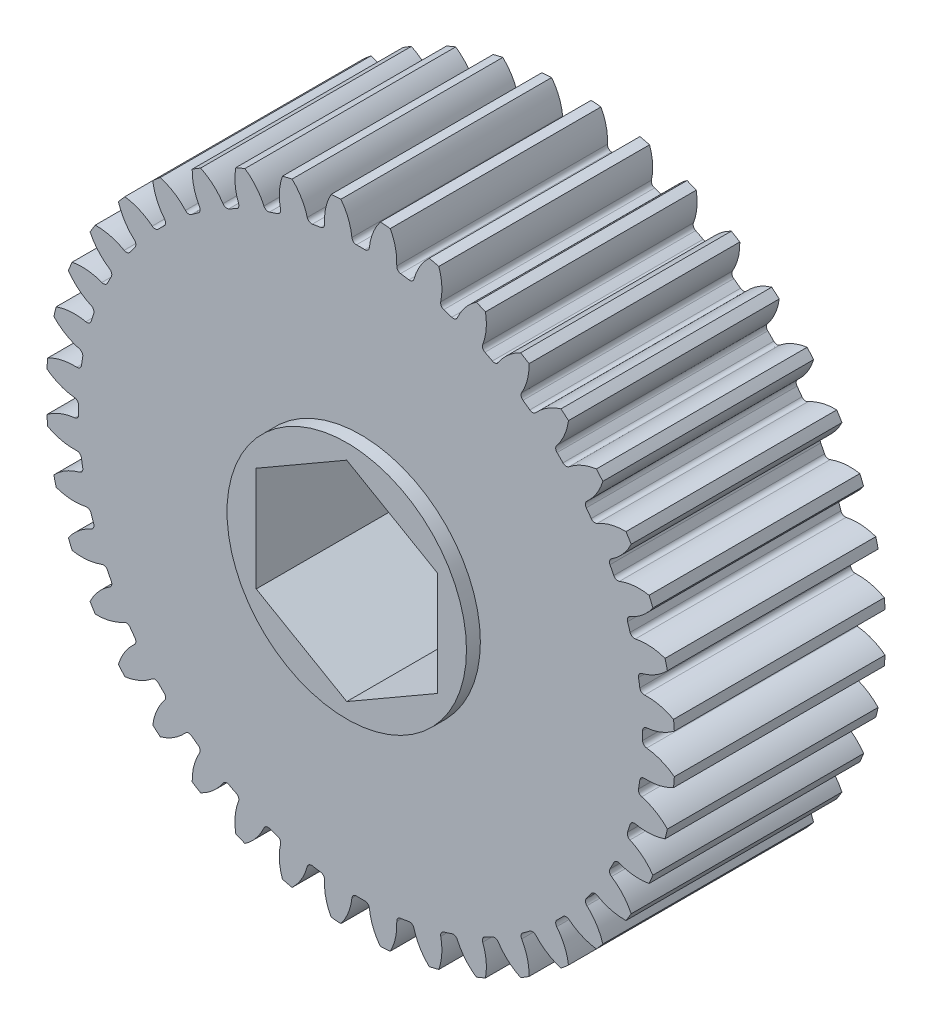
from build123d import *

# Parameters (mm, degrees)
CROQUIS1_R                 = 16.66875
SALIENTE_EXTRUIR1_DEPTH    = 5.588
CORTAR_EXTRUIR1_DEPTH      = 25.226435915
REDONDEO1_R                = 0.238142541
MATRIZC1_COUNT             = 40
REDONDEO1_OF_MATRIZC1_R    = 0.238142541
CROQUIS3_R                 = 6.35
SALIENTE_EXTRUIR2_DEPTH    = 6.3246
CORTAR_EXTRUIR2_DEPTH      = 25.362006212
CORTAR_EXTRUIR2_DEPTH_BACK = 25.362006212


with BuildPart() as part:
    # Croquis1 → Saliente-Extruir1 (new, symmetric)
    with BuildSketch(Plane.XY):
        Circle(CROQUIS1_R)
    extrude(amount=SALIENTE_EXTRUIR1_DEPTH, both=True)

    # Croquis2 → Cortar-Extruir1 (cut, symmetric)
    with BuildSketch(Plane.XY):
        with BuildLine():
            ThreePointArc((0.448148719, 14.949915755), (0, 14.95663125), (-0.448148719, 14.949915755))
            ThreePointArc((-0.448148719, 14.949915755), (-0.614972574, 15.839720541), (-1.045867644, 16.635906571))
            ThreePointArc((-1.045867644, 16.635906571), (0, 16.66875), (1.045867644, 16.635906571))
            ThreePointArc((1.045867644, 16.635906571), (0.614972574, 15.839720541), (0.448148719, 14.949915755))
        make_face()
    cortar_extruir1 = extrude(amount=CORTAR_EXTRUIR1_DEPTH, both=True, mode=Mode.SUBTRACT)

    # Redondeo1
    redondeo1_edges = [part.edges().sort_by_distance(p)[0] for p in [
        (0.448148719, 14.949915755, 0),
        (-0.448148719, 14.949915755, 0),
    ]]
    fillet(redondeo1_edges, radius=REDONDEO1_R)

    # MatrizC1: Cortar-Extruir1 ×40 about axis
    matrizc1_axis = Axis((0, 0, 0), (0, 0, 1))
    for i in range(1, MATRIZC1_COUNT):
        add(cortar_extruir1.rotate(matrizc1_axis, i * 360 / MATRIZC1_COUNT), mode=Mode.SUBTRACT)

    # Redondeo1 of MatrizC1
    redondeo1_of_matrizc1_edges = [part.edges().sort_by_distance(p)[0] for p in [
        (-1.896050809, 14.835963389, 0),
        (-2.781313338, 14.695751579, 0),
        (-4.193563273, 14.356700367, 0),
        (-5.045992792, 14.079729227, 0),
        (-6.387816292, 13.523927734, 0),
        (-7.186423157, 13.117017213, 0),
        (-8.424780074, 12.358151118, 0),
        (-9.149899933, 11.831320702, 0),
        (-10.25429781, 10.888075806, 0),
        (-10.888075806, 10.25429781, 0),
        (-11.831320702, 9.149899933, 0),
        (-12.358151118, 8.424780074, 0),
        (-13.117017213, 7.186423157, 0),
        (-13.523927734, 6.387816292, 0),
        (-14.079729227, 5.045992792, 0),
        (-14.356700367, 4.193563273, 0),
        (-14.695751579, 2.781313338, 0),
        (-14.835963389, 1.896050809, 0),
        (-14.949915755, 0.448148719, 0),
        (-14.949915755, -0.448148719, 0),
        (-14.835963389, -1.896050809, 0),
        (-14.695751579, -2.781313338, 0),
        (-14.356700367, -4.193563273, 0),
        (-14.079729227, -5.045992792, 0),
        (-13.523927734, -6.387816292, 0),
        (-13.117017213, -7.186423157, 0),
        (-12.358151118, -8.424780074, 0),
        (-11.831320702, -9.149899933, 0),
        (-10.888075806, -10.25429781, 0),
        (-10.25429781, -10.888075806, 0),
        (-9.149899933, -11.831320702, 0),
        (-8.424780074, -12.358151118, 0),
        (-7.186423157, -13.117017213, 0),
        (-6.387816292, -13.523927734, 0),
        (-5.045992792, -14.079729227, 0),
        (-4.193563273, -14.356700367, 0),
        (-2.781313338, -14.695751579, 0),
        (-1.896050809, -14.835963389, 0),
        (-0.448148719, -14.949915755, 0),
        (0.448148719, -14.949915755, 0),
        (1.896050809, -14.835963389, 0),
        (2.781313338, -14.695751579, 0),
        (4.193563273, -14.356700367, 0),
        (5.045992792, -14.079729227, 0),
        (6.387816292, -13.523927734, 0),
        (7.186423157, -13.117017213, 0),
        (8.424780074, -12.358151118, 0),
        (9.149899933, -11.831320702, 0),
        (10.25429781, -10.888075806, 0),
        (10.888075806, -10.25429781, 0),
        (11.831320702, -9.149899933, 0),
        (12.358151118, -8.424780074, 0),
        (13.117017213, -7.186423157, 0),
        (13.523927734, -6.387816292, 0),
        (14.079729227, -5.045992792, 0),
        (14.356700367, -4.193563273, 0),
        (14.695751579, -2.781313338, 0),
        (14.835963389, -1.896050809, 0),
        (14.949915755, -0.448148719, 0),
        (14.949915755, 0.448148719, 0),
        (14.835963389, 1.896050809, 0),
        (14.695751579, 2.781313338, 0),
        (14.356700367, 4.193563273, 0),
        (14.079729227, 5.045992792, 0),
        (13.523927734, 6.387816292, 0),
        (13.117017213, 7.186423157, 0),
        (12.358151118, 8.424780074, 0),
        (11.831320702, 9.149899933, 0),
        (10.888075806, 10.25429781, 0),
        (10.25429781, 10.888075806, 0),
        (9.149899933, 11.831320702, 0),
        (8.424780074, 12.358151118, 0),
        (7.186423157, 13.117017213, 0),
        (6.387816292, 13.523927734, 0),
        (5.045992792, 14.079729227, 0),
        (4.193563273, 14.356700367, 0),
        (2.781313338, 14.695751579, 0),
        (1.896050809, 14.835963389, 0),
    ]]
    fillet(redondeo1_of_matrizc1_edges, radius=REDONDEO1_OF_MATRIZC1_R)

    # Croquis3 → Saliente-Extruir2 (add, symmetric)
    with BuildSketch(Plane.XY):
        Circle(CROQUIS3_R)
    extrude(amount=SALIENTE_EXTRUIR2_DEPTH, both=True)

    # Croquis4 → Cortar-Extruir2 (cut, two sides: drawn at the far end of the back side and taken through both)
    with BuildSketch(Plane.XY.offset(-CORTAR_EXTRUIR2_DEPTH_BACK)):
        Polygon((0, 5.543255405), (-4.8006, 2.771627702), (-4.8006, -2.771627702), (0, -5.543255405), (4.8006, -2.771627702), (4.8006, 2.771627702), align=None)
    extrude(amount=CORTAR_EXTRUIR2_DEPTH + CORTAR_EXTRUIR2_DEPTH_BACK, mode=Mode.SUBTRACT)


solid = part.part
